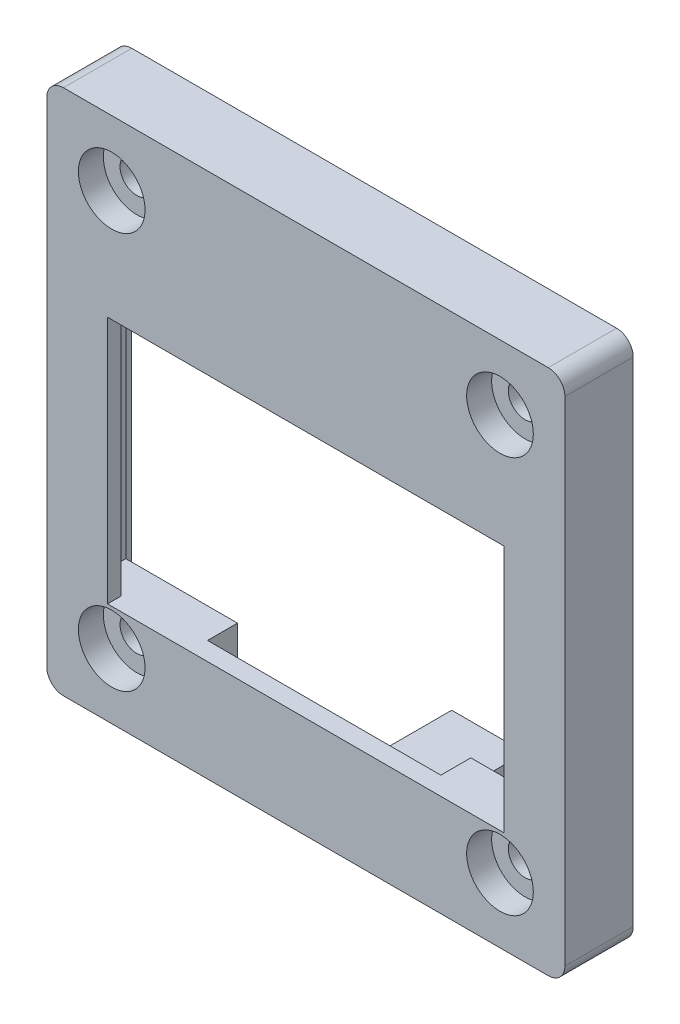
from build123d import *

# Parameters (mm, degrees)
EXTRUDE_1_DEPTH     = 2.9
CUT_EXTRUDE_1_REACH = 43.764
SKETCH_2_R          = 1
EXTRUDE_START       = 1.2
SKETCH_3_W          = 29.092354585
SKETCH_3_H          = 29.600355601
EXTRUDE_2_DEPTH     = 1.2
CUT_EXTRUDE_2_REACH = 43.864
SKETCH_4_W          = 27.4
SKETCH_4_H          = 19.4
SKETCH_5_W          = 14
SKETCH_5_H          = 5.100177801
SKETCH_5_H_2        = 5.1001778
CUT_EXTRUDE_3_DEPTH = 1.8
SKETCH_6_W          = 4.41346869
SKETCH_6_H          = 1
EXTRUDE_3_DEPTH     = 5.8
SKETCH_8_W          = 27.4
SKETCH_8_H          = 1.1
EXTRUDE_4_DEPTH     = 4.5
SKETCH_9_R          = 2
CUT_EXTRUDE_4_DEPTH = 1.5
SKETCH_10_W         = 0.8
SKETCH_10_H         = 14.9
EXTRUDE_5_DEPTH     = 1.8


with BuildPart() as part:
    # 草图1 → 凸台-拉伸1 (new body)
    with BuildSketch(Plane.XY.offset(12.2)):
        with BuildLine():
            Line((28.20505461, 1.887299975), (-0.887299975, 1.887299975))
            ThreePointArc((-0.887299975, 1.887299975), (-1.594406756, 1.594406756), (-1.887299975, 0.887299975))
            Line((-1.887299975, 0.887299975), (-1.887299975, -28.713055626))
            ThreePointArc((-1.887299975, -28.713055626), (-1.594406756, -29.420162407), (-0.887299975, -29.713055626))
            Line((-0.887299975, -29.713055626), (12.510283784, -29.713055626))
            Line((12.510283784, -29.713055626), (16.923752474, -29.713055626))
            Line((16.923752474, -29.713055626), (28.20505461, -29.713055626))
            ThreePointArc((28.20505461, -29.713055626), (28.912161391, -29.420162407), (29.20505461, -28.713055626))
            Line((29.20505461, -28.713055626), (29.20505461, 0.887299975))
            ThreePointArc((29.20505461, 0.887299975), (28.912161391, 1.594406756), (28.20505461, 1.887299975))
        make_face()
    extrude(amount=EXTRUDE_1_DEPTH)

    # 草图2 → 切除-拉伸1 (cut, up to next)
    with BuildSketch(Plane(origin=(0, 0, 12.2), x_dir=(-1, 0, 0), z_dir=(0, 0, -1)), mode=Mode.PRIVATE) as cut_extrude_1_sk1:
        with Locations((-25.308877318, -2.012877826)):
            Circle(SKETCH_2_R)
    cut_extrude_1_tool1 = extrude(cut_extrude_1_sk1.sketch, amount=-CUT_EXTRUDE_1_REACH, mode=Mode.PRIVATE) & part.part
    # 草图2 → 切除-拉伸1 (cut, up to next)
    with BuildSketch(Plane(origin=(0, 0, 12.2), x_dir=(-1, 0, 0), z_dir=(0, 0, -1)), mode=Mode.PRIVATE) as cut_extrude_1_sk2:
        with Locations((-25.308877318, -25.812877826)):
            Circle(SKETCH_2_R)
    cut_extrude_1_tool2 = extrude(cut_extrude_1_sk2.sketch, amount=-CUT_EXTRUDE_1_REACH, mode=Mode.PRIVATE) & part.part
    # 草图2 → 切除-拉伸1 (cut, up to next)
    with BuildSketch(Plane(origin=(0, 0, 12.2), x_dir=(-1, 0, 0), z_dir=(0, 0, -1)), mode=Mode.PRIVATE) as cut_extrude_1_sk3:
        with Locations((-2.008877318, -25.812877826)):
            Circle(SKETCH_2_R)
    cut_extrude_1_tool3 = extrude(cut_extrude_1_sk3.sketch, amount=-CUT_EXTRUDE_1_REACH, mode=Mode.PRIVATE) & part.part
    # 草图2 → 切除-拉伸1 (cut, up to next)
    with BuildSketch(Plane(origin=(0, 0, 12.2), x_dir=(-1, 0, 0), z_dir=(0, 0, -1)), mode=Mode.PRIVATE) as cut_extrude_1_sk4:
        with Locations(Location((-2.008877318, -2.012877826, 0), (0, 0, 180))):
            Circle(SKETCH_2_R)
    cut_extrude_1_tool4 = extrude(cut_extrude_1_sk4.sketch, amount=-CUT_EXTRUDE_1_REACH, mode=Mode.PRIVATE) & part.part
    add(cut_extrude_1_tool1.solids().sort_by_distance((25.308877, -2.012878, 12.2))[0], mode=Mode.SUBTRACT)
    add(cut_extrude_1_tool2.solids().sort_by_distance((25.308877, -25.812878, 12.2))[0], mode=Mode.SUBTRACT)
    add(cut_extrude_1_tool3.solids().sort_by_distance((2.008877, -25.812878, 12.2))[0], mode=Mode.SUBTRACT)
    add(cut_extrude_1_tool4.solids().sort_by_distance((2.008877, -2.012878, 12.2))[0], mode=Mode.SUBTRACT)

    # 草图3 → 凸台-拉伸2 (add)
    with BuildSketch(Plane(origin=(0, 0, 12.2), x_dir=(-1, 0, 0), z_dir=(0, 0, -1)).offset(EXTRUDE_START)):
        with BuildLine():
            Line((0.887299975, 1.887299975), (-28.20505461, 1.887299975))
            ThreePointArc((-28.20505461, 1.887299975), (-28.912161391, 1.594406756), (-29.20505461, 0.887299975))
            Line((-29.20505461, 0.887299975), (-29.20505461, -28.713055626))
            ThreePointArc((-29.20505461, -28.713055626), (-28.912161391, -29.420162407), (-28.20505461, -29.713055626))
            Line((-28.20505461, -29.713055626), (0.887299975, -29.713055626))
            ThreePointArc((0.887299975, -29.713055626), (1.594406756, -29.420162407), (1.887299975, -28.713055626))
            Line((1.887299975, -28.713055626), (1.887299975, 0.887299975))
            ThreePointArc((1.887299975, 0.887299975), (1.594406756, 1.594406756), (0.887299975, 1.887299975))
        make_face()
        with Locations((-13.658877318, -13.912877826)):
            Rectangle(SKETCH_3_W, SKETCH_3_H, mode=Mode.SUBTRACT)
    extrude(amount=-EXTRUDE_2_DEPTH)

    # 草图4 → 切除-拉伸2 (cut, up to next)
    with BuildSketch(Plane.XY.offset(15.1), mode=Mode.PRIVATE) as cut_extrude_2_sk1:
        with Locations((13.658877318, -13.912877826)):
            Rectangle(SKETCH_4_W, SKETCH_4_H)
    cut_extrude_2_tool1 = extrude(cut_extrude_2_sk1.sketch, amount=-CUT_EXTRUDE_2_REACH, mode=Mode.PRIVATE) & part.part
    add(cut_extrude_2_tool1.solids().sort_by_distance((13.658877, -13.912878, 15.1))[0], mode=Mode.SUBTRACT)

    # 草图5 → 切除-拉伸3 (cut)
    with BuildSketch(Plane(origin=(0, 0, 12.2), x_dir=(-1, 0, 0), z_dir=(0, 0, -1))):
        with Locations((-13.658877318, -1.662788926)):
            Rectangle(SKETCH_5_W, SKETCH_5_H)
        with Locations((-13.658877318, -26.162966726)):
            Rectangle(SKETCH_5_W, SKETCH_5_H_2)
    extrude(amount=-CUT_EXTRUDE_3_DEPTH, mode=Mode.SUBTRACT)

    # 草图6 → 凸台-拉伸3 (add)
    with BuildSketch(Plane(origin=(0, 0, 11), x_dir=(-1, 0, 0), z_dir=(0, 0, -1))):
        with Locations((-14.717018129, -29.213055626)):
            Rectangle(SKETCH_6_W, SKETCH_6_H)
    extrude(amount=EXTRUDE_3_DEPTH)

    # 草图8 → 凸台-拉伸4 (add)
    with BuildSketch(Plane(origin=(0, -4.212877826, 0), x_dir=(1, 0, 0), z_dir=(0, 1, 0))):
        with Locations((13.658877318, -14.55)):
            Rectangle(SKETCH_8_W, SKETCH_8_H)
    extrude(amount=-EXTRUDE_4_DEPTH)

    # 草图9 → 切除-拉伸4 (cut)
    with BuildSketch(Plane.XY.offset(15.1)):
        with Locations((25.308877318, -2.012877826)):
            Circle(SKETCH_9_R)
        with Locations((2.008877318, -2.012877826)):
            Circle(SKETCH_9_R)
        with Locations((2.008877318, -25.812877826)):
            Circle(SKETCH_9_R)
        with Locations((25.308877318, -25.812877826)):
            Circle(SKETCH_9_R)
    extrude(amount=-CUT_EXTRUDE_4_DEPTH, mode=Mode.SUBTRACT)

    # 草图10 → 凸台-拉伸5 (add)
    with BuildSketch(Plane(origin=(-0.041122682, 0, 0), x_dir=(0, 0, -1), z_dir=(1, 0, 0))):
        with Locations((-14.7, -16.162877826)):
            Rectangle(SKETCH_10_W, SKETCH_10_H)
    extrude_5 = extrude(amount=EXTRUDE_5_DEPTH)

    # 镜向1: 凸台-拉伸5 across plane
    add(extrude_5.mirror(Plane(origin=(13.658877318, 0, 0), x_dir=(0, 0, 1), z_dir=(1, 0, 0))))


solid = part.part
